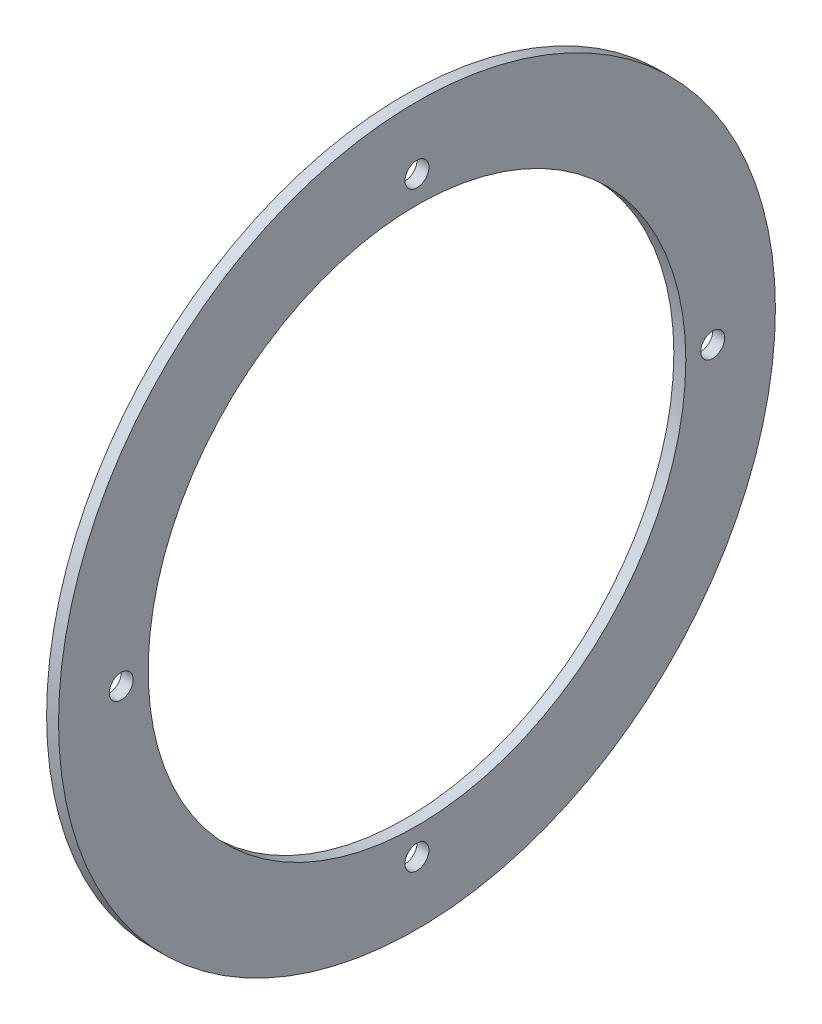
from build123d import *

# Parameters (mm, degrees)
SKETCH_1_R      = 60
SKETCH_1_R_2    = 45
SKETCH_1_R_3    = 2
EXTRUDE_1_DEPTH = 2


with BuildPart() as part:
    # 草图1 → 凸台-拉伸1 (new body)
    with BuildSketch(Plane(origin=(0, 0, 0), x_dir=(0, 0, -1), z_dir=(1, 0, 0))):
        Circle(SKETCH_1_R)
        Circle(SKETCH_1_R_2, mode=Mode.SUBTRACT)
        with Locations((0, 49.5)):
            Circle(SKETCH_1_R_3, mode=Mode.SUBTRACT)
        with Locations((-49.5, 0)):
            Circle(SKETCH_1_R_3, mode=Mode.SUBTRACT)
        with Locations((0, -49.5)):
            Circle(SKETCH_1_R_3, mode=Mode.SUBTRACT)
        with Locations((49.5, 0)):
            Circle(SKETCH_1_R_3, mode=Mode.SUBTRACT)
    extrude(amount=EXTRUDE_1_DEPTH)


solid = part.part
